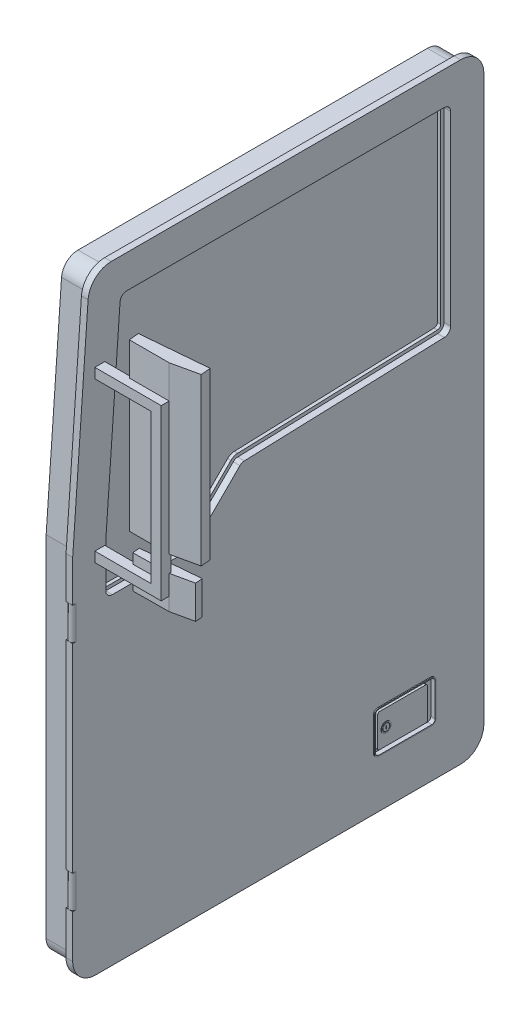
from build123d import *

# Parameters (mm, degrees)
BOSS_EXTRUDE1_DEPTH     = 20
BOSS_EXTRUDE2_DEPTH     = 100
CUT_EXTRUDE1_DEPTH      = 20
CUT_EXTRUDE2_DEPTH      = 30
CUT_EXTRUDE3_START      = -20
CUT_EXTRUDE3_DEPTH      = 20
CUT_EXTRUDE4_START      = -60
CUT_EXTRUDE4_DEPTH      = 60
CUT_EXTRUDE5_DEPTH      = 100
LPATTERN1_COUNT         = 2
LPATTERN1_PITCH         = 700
CUT_EXTRUDE6_DEPTH      = 10
BOSS_EXTRUDE3_START     = 3
BOSS_EXTRUDE3_DEPTH     = 3
BOSS_EXTRUDE4_DEPTH     = 10
SKETCH10_R              = 15
SKETCH10_W              = 2
SKETCH10_H              = 10
BOSS_EXTRUDE5_DEPTH     = 1
SKETCH10_2_W            = 2
SKETCH10_2_H            = 10
CUT_EXTRUDE8_DEPTH      = 20
SKETCH11_R              = 11.328659538
SKETCH11_R_2            = 10.328659538
CUT_EXTRUDE_THIN1_DEPTH = 5
SKETCH12_W              = 30
SKETCH12_H              = 30
BOSS_EXTRUDE6_DEPTH     = 200
SKETCH13_W              = 30
SKETCH13_H              = 510
BOSS_EXTRUDE7_DEPTH     = 30
BOSS_EXTRUDE8_DEPTH     = 500
SKETCH15_W              = 192
SKETCH15_H              = 492
CUT_EXTRUDE9_DEPTH      = 10
SKETCH16_R              = 50
BOSS_EXTRUDE9_DEPTH     = 0.5
DOME1_FACE_RADIUS       = 50
DOME1_HEIGHT            = 5
BOSS_EXTRUDE10_DEPTH    = 100
BOSS_EXTRUDE11_DEPTH    = 50
BOSS_EXTRUDE12_DEPTH    = 5
SKETCH21_W              = 115.49405633
SKETCH21_H              = 65.03548803
CUT_EXTRUDE10_DEPTH     = 15
BOSS_EXTRUDE13_DEPTH    = 5
BOSS_EXTRUDE14_DEPTH    = 8
SKETCH24_W              = 115.49405633
SKETCH24_H              = 65.03548803
BOSS_EXTRUDE15_DEPTH    = 2
CUT_EXTRUDE11_DEPTH     = 20


with BuildPart() as part:
    # Sketch1 → Boss-Extrude1 (new body)
    with BuildSketch(Plane(origin=(950, 0, 0), x_dir=(0, 0, -1), z_dir=(1, 0, 0))):
        with BuildLine():
            Line((-503.725851954, 1820), (550, 1820))
            ThreePointArc((550, 1820), (599.497474683, 1799.497474683), (620, 1750))
            Line((620, 1750), (620, 50))
            ThreePointArc((620, 50), (599.497474683, 0.502525317), (550, -20))
            Line((550, -20), (-550, -20))
            ThreePointArc((-550, -20), (-599.497474683, 0.502525317), (-620, 50))
            Line((-620, 50), (-620, 1105.358070871))
            Line((-620, 1105.358070871), (-573.547579202, 1754.992634989))
            ThreePointArc((-573.547579202, 1754.992634989), (-551.425514169, 1801.232238138), (-503.725851954, 1820))
        make_face()
        with BuildLine():
            Line((-550, 0), (550, 0))
            ThreePointArc((550, 0), (585.355339059, 14.644660941), (600, 50))
            Line((600, 50), (600, 1750))
            ThreePointArc((600, 1750), (585.355339059, 1785.355339059), (550, 1800))
            Line((550, 1800), (-503.725851954, 1800))
            ThreePointArc((-503.725851954, 1800), (-537.797039251, 1786.594455813), (-553.598514274, 1753.566167849))
            Line((-553.598514274, 1753.566167849), (-600, 1104.643927928))
            Line((-600, 1104.643927928), (-600, 50))
            ThreePointArc((-600, 50), (-585.355339059, 14.644660941), (-550, 0))
        make_face(mode=Mode.SUBTRACT)
    extrude(amount=-BOSS_EXTRUDE1_DEPTH)

    # Sketch1<2> → Boss-Extrude2 (add)
    with BuildSketch(Plane(origin=(950, 0, 0), x_dir=(0, 0, -1), z_dir=(1, 0, 0))):
        with BuildLine():
            ThreePointArc((-550, 0), (-585.355339059, 14.644660941), (-600, 50))
            Line((-600, 50), (-600, 1104.643927928))
            Line((-600, 1104.643927928), (-553.598514274, 1753.566167849))
            ThreePointArc((-553.598514274, 1753.566167849), (-537.797039251, 1786.594455813), (-503.725851954, 1800))
            Line((-503.725851954, 1800), (550, 1800))
            ThreePointArc((550, 1800), (585.355339059, 1785.355339059), (600, 1750))
            Line((600, 1750), (600, 50))
            ThreePointArc((600, 50), (585.355339059, 14.644660941), (550, 0))
            Line((550, 0), (-550, 0))
        make_face()
    extrude(amount=-BOSS_EXTRUDE2_DEPTH)

    # Sketch2 → Cut-Extrude1 (cut)
    with BuildSketch(Plane(origin=(950, 0, 0), x_dir=(0, 0, -1), z_dir=(1, 0, 0))):
        with BuildLine():
            Line((-520.25467536, 1098.225735172), (-520.25467536, 968.225735172))
            ThreePointArc((-520.25467536, 968.225735172), (-514.396810984, 954.083599549), (-500.25467536, 948.225735172))
            Line((-500.25467536, 948.225735172), (-268.675253429, 948.225735172))
            ThreePointArc((-268.675253429, 948.225735172), (-261.032514224, 949.743621185), (-254.549855712, 954.066881428))
            Line((-254.549855712, 954.066881428), (-115.620160145, 1092.668299305))
            ThreePointArc((-115.620160145, 1092.668299305), (-109.455585902, 1096.856796585), (-102.185542157, 1098.497512584))
            Line((-102.185542157, 1098.497512584), (500.690779728, 1119.332680948))
            ThreePointArc((500.690779728, 1119.332680948), (514.384289947, 1125.424985931), (520, 1139.320747973))
            Line((520, 1139.320747973), (520, 1700))
            ThreePointArc((520, 1700), (514.142135624, 1714.142135624), (500, 1720))
            Line((500, 1720), (-457.173462338, 1720))
            ThreePointArc((-457.173462338, 1720), (-470.801937256, 1714.637782325), (-477.122527266, 1701.42646714))
            Line((-477.122527266, 1701.42646714), (-520.25467536, 1098.225735172))
        make_face()
        with BuildLine():
            Line((500, 1710), (-457.173462338, 1710))
            ThreePointArc((-457.173462338, 1710), (-463.987699797, 1707.318891163), (-467.147994802, 1700.71323357))
            Line((-467.147994802, 1700.71323357), (-510.25467536, 1097.868663701))
            Line((-510.25467536, 1097.868663701), (-510.25467536, 968.225735172))
            ThreePointArc((-510.25467536, 968.225735172), (-507.325743172, 961.15466736), (-500.25467536, 958.225735172))
            Line((-500.25467536, 958.225735172), (-268.675253429, 958.225735172))
            ThreePointArc((-268.675253429, 958.225735172), (-264.853883826, 958.984678179), (-261.61255457, 961.1463083))
            Line((-261.61255457, 961.1463083), (-122.682859003, 1099.747726177))
            ThreePointArc((-122.682859003, 1099.747726177), (-113.435997639, 1106.030472097), (-102.530932021, 1108.491546097))
            Line((-102.530932021, 1108.491546097), (500.345389864, 1129.326714461))
            ThreePointArc((500.345389864, 1129.326714461), (507.192144974, 1132.372866952), (510, 1139.320747973))
            Line((510, 1139.320747973), (510, 1700))
            ThreePointArc((510, 1700), (507.071067812, 1707.071067812), (500, 1710))
        make_face(mode=Mode.SUBTRACT)
    extrude(amount=-CUT_EXTRUDE1_DEPTH, mode=Mode.SUBTRACT)

    # Sketch2<2> → Cut-Extrude2 (cut)
    with BuildSketch(Plane(origin=(950, 0, 0), x_dir=(0, 0, -1), z_dir=(1, 0, 0))):
        with BuildLine():
            Line((510, 1139.320747973), (510, 1700))
            ThreePointArc((510, 1700), (507.071067812, 1707.071067812), (500, 1710))
            Line((500, 1710), (-457.173462338, 1710))
            ThreePointArc((-457.173462338, 1710), (-463.987699797, 1707.318891163), (-467.147994802, 1700.71323357))
            Line((-467.147994802, 1700.71323357), (-510.25467536, 1097.868663701))
            Line((-510.25467536, 1097.868663701), (-510.25467536, 968.225735172))
            ThreePointArc((-510.25467536, 968.225735172), (-507.325743172, 961.15466736), (-500.25467536, 958.225735172))
            Line((-500.25467536, 958.225735172), (-268.675253429, 958.225735172))
            ThreePointArc((-268.675253429, 958.225735172), (-264.853883826, 958.984678179), (-261.61255457, 961.1463083))
            Line((-261.61255457, 961.1463083), (-122.682859003, 1099.747726177))
            ThreePointArc((-122.682859003, 1099.747726177), (-113.435997639, 1106.030472097), (-102.530932021, 1108.491546097))
            Line((-102.530932021, 1108.491546097), (500.345389864, 1129.326714461))
            ThreePointArc((500.345389864, 1129.326714461), (507.192144974, 1132.372866952), (510, 1139.320747973))
        make_face()
    extrude(amount=-CUT_EXTRUDE2_DEPTH, mode=Mode.SUBTRACT)

    # Sketch3 → Cut-Extrude3 (cut)
    with BuildSketch(Plane.ZY.offset(-850).offset(CUT_EXTRUDE3_START)):
        with BuildLine():
            Line((-520, 1700), (-520, 1139.320747973))
            ThreePointArc((-520, 1139.320747973), (-514.384289947, 1125.424985931), (-500.690779728, 1119.332680948))
            Line((-500.690779728, 1119.332680948), (102.185542157, 1098.497512584))
            ThreePointArc((102.185542157, 1098.497512584), (109.455585902, 1096.856796585), (115.620160145, 1092.668299305))
            Line((115.620160145, 1092.668299305), (254.549855712, 954.066881428))
            ThreePointArc((254.549855712, 954.066881428), (261.032514224, 949.743621185), (268.675253429, 948.225735172))
            Line((268.675253429, 948.225735172), (500.25467536, 948.225735172))
            ThreePointArc((500.25467536, 948.225735172), (514.396810984, 954.083599549), (520.25467536, 968.225735172))
            Line((520.25467536, 968.225735172), (520.25467536, 1098.225735172))
            Line((520.25467536, 1098.225735172), (477.122527266, 1701.42646714))
            ThreePointArc((477.122527266, 1701.42646714), (470.801937256, 1714.637782325), (457.173462338, 1720))
            Line((457.173462338, 1720), (-500, 1720))
            ThreePointArc((-500, 1720), (-514.142135624, 1714.142135624), (-520, 1700))
        make_face()
        with BuildLine():
            Line((-500, 1710), (457.173462338, 1710))
            ThreePointArc((457.173462338, 1710), (463.987699797, 1707.318891163), (467.147994802, 1700.71323357))
            Line((467.147994802, 1700.71323357), (510.25467536, 1097.868663701))
            Line((510.25467536, 1097.868663701), (510.25467536, 968.225735172))
            ThreePointArc((510.25467536, 968.225735172), (507.325743172, 961.15466736), (500.25467536, 958.225735172))
            Line((500.25467536, 958.225735172), (268.675253429, 958.225735172))
            ThreePointArc((268.675253429, 958.225735172), (264.853883826, 958.984678179), (261.61255457, 961.1463083))
            Line((261.61255457, 961.1463083), (122.682859003, 1099.747726177))
            ThreePointArc((122.682859003, 1099.747726177), (113.435997639, 1106.030472097), (102.530932021, 1108.491546097))
            Line((102.530932021, 1108.491546097), (-500.345389864, 1129.326714461))
            ThreePointArc((-500.345389864, 1129.326714461), (-507.192144974, 1132.372866952), (-510, 1139.320747973))
            Line((-510, 1139.320747973), (-510, 1700))
            ThreePointArc((-510, 1700), (-507.071067812, 1707.071067812), (-500, 1710))
        make_face(mode=Mode.SUBTRACT)
    extrude(amount=CUT_EXTRUDE3_DEPTH, mode=Mode.SUBTRACT)

    # Sketch3<2> → Cut-Extrude4 (cut)
    with BuildSketch(Plane.ZY.offset(-850).offset(CUT_EXTRUDE4_START)):
        with BuildLine():
            Line((-510, 1700), (-510, 1139.320747973))
            ThreePointArc((-510, 1139.320747973), (-507.192144974, 1132.372866952), (-500.345389864, 1129.326714461))
            Line((-500.345389864, 1129.326714461), (102.530932021, 1108.491546097))
            ThreePointArc((102.530932021, 1108.491546097), (113.435997639, 1106.030472097), (122.682859003, 1099.747726177))
            Line((122.682859003, 1099.747726177), (261.61255457, 961.1463083))
            ThreePointArc((261.61255457, 961.1463083), (264.853883826, 958.984678179), (268.675253429, 958.225735172))
            Line((268.675253429, 958.225735172), (500.25467536, 958.225735172))
            ThreePointArc((500.25467536, 958.225735172), (507.325743172, 961.15466736), (510.25467536, 968.225735172))
            Line((510.25467536, 968.225735172), (510.25467536, 1097.868663701))
            Line((510.25467536, 1097.868663701), (467.147994802, 1700.71323357))
            ThreePointArc((467.147994802, 1700.71323357), (463.987699797, 1707.318891163), (457.173462338, 1710))
            Line((457.173462338, 1710), (-500, 1710))
            ThreePointArc((-500, 1710), (-507.071067812, 1707.071067812), (-510, 1700))
        make_face()
    extrude(amount=CUT_EXTRUDE4_DEPTH, mode=Mode.SUBTRACT)

    # Sketch4 → Cut-Extrude5 (cut)
    with BuildSketch(Plane.XZ.offset(-180)):
        with BuildLine():
            Line((930, 624.556143677), (930, 610))
            ThreePointArc((930, 610), (940, 620), (950, 610))
            Line((950, 610), (950, 624.556143677))
            Line((950, 624.556143677), (930, 624.556143677))
        make_face()
    cut_extrude5 = extrude(amount=-CUT_EXTRUDE5_DEPTH, mode=Mode.SUBTRACT)

    # LPattern1: Cut-Extrude5 ×2
    with Locations(*[(0, i * LPATTERN1_PITCH, 0) for i in range(1, LPATTERN1_COUNT)]):
        add(cut_extrude5, mode=Mode.SUBTRACT)

    # Sketch5 → Cut-Extrude6 (cut)
    with BuildSketch(Plane(origin=(950, 0, 0), x_dir=(0, 0, -1), z_dir=(1, 0, 0))):
        with BuildLine():
            Line((460, 250), (300, 250))
            ThreePointArc((300, 250), (292.928932188, 247.071067812), (290, 240))
            Line((290, 240), (290, 140))
            ThreePointArc((290, 140), (292.928932188, 132.928932188), (300, 130))
            Line((300, 130), (460, 130))
            ThreePointArc((460, 130), (467.071067812, 132.928932188), (470, 140))
            Line((470, 140), (470, 240))
            ThreePointArc((470, 240), (467.071067812, 247.071067812), (460, 250))
        make_face()
    extrude(amount=-CUT_EXTRUDE6_DEPTH, mode=Mode.SUBTRACT)

    # Sketch5<3> → Boss-Extrude3 (add)
    with BuildSketch(Plane(origin=(950, 0, 0), x_dir=(0, 0, -1), z_dir=(1, 0, 0)).offset(BOSS_EXTRUDE3_START)):
        with BuildLine():
            Line((460, 253), (300, 253))
            ThreePointArc((300, 253), (290.807611845, 249.192388155), (287, 240))
            Line((287, 240), (287, 140))
            ThreePointArc((287, 140), (290.807611845, 130.807611845), (300, 127))
            Line((300, 127), (460, 127))
            ThreePointArc((460, 127), (469.192388155, 130.807611845), (473, 140))
            Line((473, 140), (473, 240))
            ThreePointArc((473, 240), (469.192388155, 249.192388155), (460, 253))
        make_face()
        with BuildLine():
            Line((460, 130), (300, 130))
            ThreePointArc((300, 130), (292.928932188, 132.928932188), (290, 140))
            Line((290, 140), (290, 240))
            ThreePointArc((290, 240), (292.928932188, 247.071067812), (300, 250))
            Line((300, 250), (460, 250))
            ThreePointArc((460, 250), (467.071067812, 247.071067812), (470, 240))
            Line((470, 240), (470, 140))
            ThreePointArc((470, 140), (467.071067812, 132.928932188), (460, 130))
        make_face(mode=Mode.SUBTRACT)
    extrude(amount=-BOSS_EXTRUDE3_DEPTH)

    # Sketch6 → Boss-Extrude4 (add)
    with BuildSketch(Plane(origin=(940, 0, 0), x_dir=(0, 0, -1), z_dir=(1, 0, 0))):
        with BuildLine():
            Line((305, 240), (445, 240))
            ThreePointArc((445, 240), (448.535533906, 238.535533906), (450, 235))
            Line((450, 235), (450, 145))
            ThreePointArc((450, 145), (448.535533906, 141.464466094), (445, 140))
            Line((445, 140), (305, 140))
            ThreePointArc((305, 140), (301.464466094, 141.464466094), (300, 145))
            Line((300, 145), (300, 235))
            ThreePointArc((300, 235), (301.464466094, 238.535533906), (305, 240))
        make_face()
    extrude(amount=BOSS_EXTRUDE4_DEPTH)

    # Sketch10 → Boss-Extrude5 (add)
    with BuildSketch(Plane(origin=(950, 0, 0), x_dir=(0, 0, -1), z_dir=(1, 0, 0))):
        with Locations((324.797279871, 190)):
            Circle(SKETCH10_R)
        with Locations((324.797279871, 190)):
            Rectangle(SKETCH10_W, SKETCH10_H, mode=Mode.SUBTRACT)
    extrude(amount=BOSS_EXTRUDE5_DEPTH)

    # Sketch10<2> → Cut-Extrude8 (cut)
    with BuildSketch(Plane(origin=(950, 0, 0), x_dir=(0, 0, -1), z_dir=(1, 0, 0))):
        with Locations((324.797279871, 190)):
            Rectangle(SKETCH10_2_W, SKETCH10_2_H)
    extrude(amount=-CUT_EXTRUDE8_DEPTH, mode=Mode.SUBTRACT)

    # Sketch11 → Cut-Extrude-Thin1 (cut)
    with BuildSketch(Plane(origin=(951, 0, 0), x_dir=(0, 0, -1), z_dir=(1, 0, 0))):
        with Locations((324.797279871, 190)):
            Circle(SKETCH11_R)
        with Locations((324.797279871, 190)):
            Circle(SKETCH11_R_2, mode=Mode.SUBTRACT)
    extrude(amount=-CUT_EXTRUDE_THIN1_DEPTH, mode=Mode.SUBTRACT)

    # Sketch12 → Boss-Extrude6 (add)
    with BuildSketch(Plane(origin=(950, 0, 0), x_dir=(0, 0, -1), z_dir=(1, 0, 0))):
        with Locations((-538.114893912, 1073.225735172)):
            Rectangle(SKETCH12_W, SKETCH12_H)
        with Locations((-538.114893912, 1553.225735172)):
            Rectangle(SKETCH12_W, SKETCH12_H)
    extrude(amount=BOSS_EXTRUDE6_DEPTH)

    # Sketch13 → Boss-Extrude7 (add)
    with BuildSketch(Plane(origin=(1150, 0, 0), x_dir=(0, 0, -1), z_dir=(1, 0, 0))):
        with Locations((-538.114893912, 1313.225735172)):
            Rectangle(SKETCH13_W, SKETCH13_H)
    extrude(amount=-BOSS_EXTRUDE7_DEPTH)

    # Sketch14 → Boss-Extrude8 (add)
    with BuildSketch(Plane(origin=(0, 1668.225735172, 0), x_dir=(-1, 0, 0), z_dir=(0, 1, 0))):
        Polygon((-1030, 529.136463028), (-1027.385327718, 499.250622085), (-1226.624267336, 481.819473536), (-1229.238939618, 511.705314479), (-1150, 529.136463028), align=None)
    extrude(amount=-BOSS_EXTRUDE8_DEPTH)

    # Sketch15 → Cut-Extrude9 (cut)
    with BuildSketch(Plane(origin=(51.151126187, 0, 584.660047666), x_dir=(-0.9961946980917455, 0, 0.08715574274765854), z_dir=(-0.08715574274765855, 0, -0.9961946980917457))):
        with Locations((-1079.963257584, 1418.225735172)):
            Rectangle(SKETCH15_W, SKETCH15_H)
    extrude(amount=-CUT_EXTRUDE9_DEPTH, mode=Mode.SUBTRACT)

    # Sketch16 → Boss-Extrude9 (add)
    with BuildSketch(Plane(origin=(52.022683615, 0, 594.621994647), x_dir=(-0.9961946980917455, 0, 0.08715574274765847), z_dir=(-0.08715574274765849, 0, -0.9961946980917457))):
        with Locations((-1053.963257584, 1242.225735172)):
            Circle(SKETCH16_R)
    extrude(amount=BOSS_EXTRUDE9_DEPTH)

    # Dome1: a dome of height H over a round flat face of radius A is a cap of a sphere of radius (A * A + H * H) / (2 * H)
    dome1_r = (DOME1_FACE_RADIUS * DOME1_FACE_RADIUS + DOME1_HEIGHT * DOME1_HEIGHT) / (2 * DOME1_HEIGHT)
    dome1_base = Plane((1101.931714932, 1242.225735172, 502.264946754), z_dir=(-0.087155742748, 0, -0.996194698092))
    with Locations(dome1_base.offset(DOME1_HEIGHT - dome1_r)):
        dome1_ball = Sphere(dome1_r, mode=Mode.PRIVATE)
    add(split(dome1_ball, bisect_by=dome1_base, keep=Keep.TOP, mode=Mode.PRIVATE))

    # Sketch18 → Boss-Extrude10 (add)
    with BuildSketch(Plane.XZ.offset(-1118.225735172)):
        Polygon((1039.364418554, 508.240785813), (1213.69849072, 492.988530833), (1215.59851981, 514.705962709), (1150, 529.136463028), (1041.264447644, 529.95821769), align=None)
    extrude(amount=BOSS_EXTRUDE10_DEPTH)

    # Sketch19 → Boss-Extrude11 (add)
    with BuildSketch(Plane.ZY.offset(-850)):
        Polygon((-517.173669973, 1027.279558705), (80.591438476, 1001.289771381), (267.24536562, 864.252710946), (267.24536562, 748.480021958), (-517.173669973, 748.480021958), align=None)
        Polygon((267.24536562, 581.383812381), (267.24536562, 406.527396319), (173.918402048, 325.198830708), (-517.173669973, 325.198830708), (-517.173669973, 581.383812381), (-513.173669973, 581.383812381), (-513.173669973, 329.198830708), (172.420073773, 329.198830708), (263.24536562, 408.347347111), (263.24536562, 581.383812381), align=None)
    extrude(amount=BOSS_EXTRUDE11_DEPTH)

    # Sketch20 → Boss-Extrude12 (add)
    with BuildSketch(Plane.ZY.offset(-800)):
        Polygon((-517.173669973, 581.383812381), (267.24536562, 581.383812381), (267.24536562, 406.527396319), (173.918402048, 325.198830708), (-517.173669973, 325.198830708), align=None)
        Polygon((-517.173669973, 900), (-517.173669973, 748.480021958), (267.24536562, 748.480021958), (267.24536562, 864.252710946), (-171.627633962, 900), align=None)
    extrude(amount=BOSS_EXTRUDE12_DEPTH)

    # Sketch21 → Cut-Extrude10 (cut)
    with BuildSketch(Plane.ZY.offset(-800)):
        with Locations((17.012296449, 941.805084581)):
            Rectangle(SKETCH21_W, SKETCH21_H)
    extrude(amount=-CUT_EXTRUDE10_DEPTH, mode=Mode.SUBTRACT)

    # Sketch22 → Boss-Extrude13 (add)
    with BuildSketch(Plane.ZY.offset(-815)):
        Polygon((-40.734731716, 971.050259942), (-10.48897243, 971.050259942), (-4.305379278, 934.390386254), (-4.305379278, 913.189495447), (-40.734731716, 913.189495447), align=None)
    extrude(amount=BOSS_EXTRUDE13_DEPTH)

    # Sketch23 → Boss-Extrude14 (add)
    with BuildSketch(Plane.ZY.offset(-810)):
        Polygon((-40.734731716, 971.050259942), (-10.48897243, 971.050259942), (-4.305379278, 934.390386254), (68.572682872, 934.390386254), (68.572682872, 913.189495447), (-40.734731716, 913.189495447), align=None)
    extrude(amount=BOSS_EXTRUDE14_DEPTH)

    # Sketch24 → Boss-Extrude15 (add)
    with BuildSketch(Plane.ZY.offset(-800)):
        with BuildLine():
            Line((-44.734731716, 976.322828596), (-44.734731716, 907.287340566))
            ThreePointArc((-44.734731716, 907.287340566), (-44.148945278, 905.873127003), (-42.734731716, 905.287340566))
            Line((-42.734731716, 905.287340566), (76.759324614, 905.287340566))
            ThreePointArc((76.759324614, 905.287340566), (78.173538176, 905.873127003), (78.759324614, 907.287340566))
            Line((78.759324614, 907.287340566), (78.759324614, 976.322828596))
            ThreePointArc((78.759324614, 976.322828596), (78.173538176, 977.737042158), (76.759324614, 978.322828596))
            Line((76.759324614, 978.322828596), (-42.734731716, 978.322828596))
            ThreePointArc((-42.734731716, 978.322828596), (-44.148945278, 977.737042158), (-44.734731716, 976.322828596))
        make_face()
        with Locations((17.012296449, 941.805084581)):
            Rectangle(SKETCH24_W, SKETCH24_H, mode=Mode.SUBTRACT)
    extrude(amount=BOSS_EXTRUDE15_DEPTH)

    # Sketch25 → Cut-Extrude11 (cut)
    with BuildSketch(Plane.ZY.offset(-815)):
        Polygon((-9.012720346, 974.322828596), (1.957121008, 909.287340566), (74.759324614, 909.287340566), (74.759324614, 974.322828596), align=None)
    extrude(amount=-CUT_EXTRUDE11_DEPTH, mode=Mode.SUBTRACT)


solid = part.part
